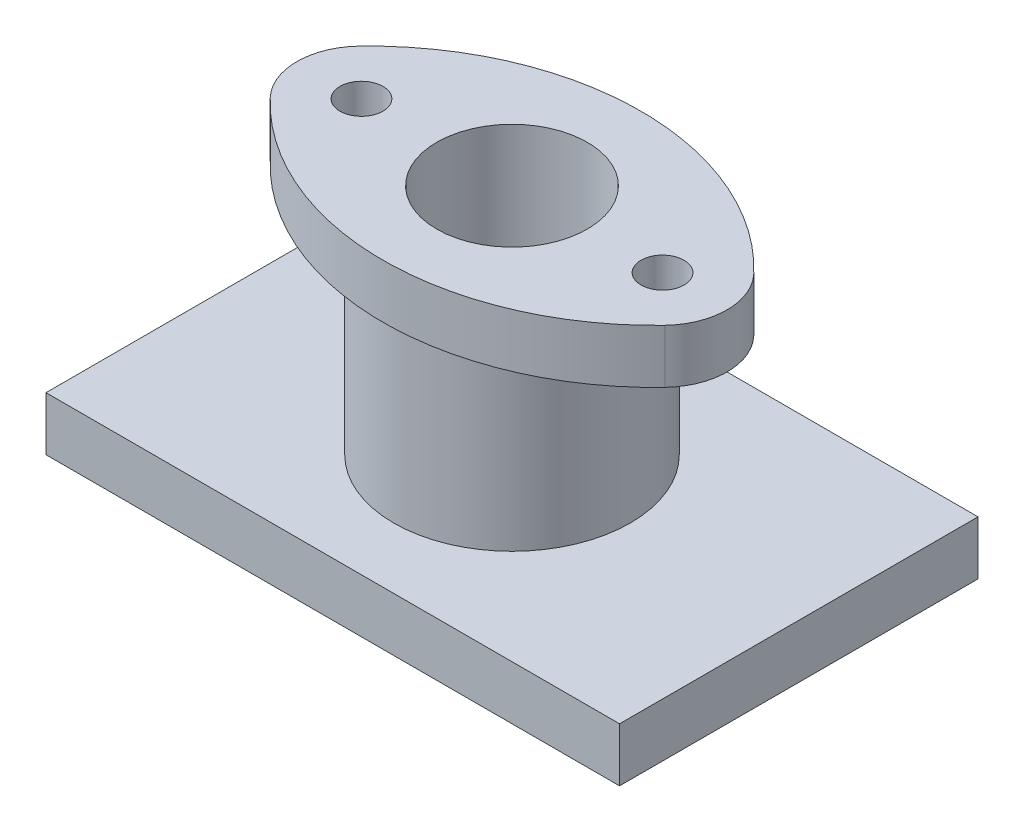
from build123d import *

# Parameters (mm, degrees)
SKETCH1_W           = 160
SKETCH1_H           = 100
BOSS_EXTRUDE1_DEPTH = 15
SKETCH3_R           = 16.5
CUT_EXTRUDE1_DEPTH  = 15
SKETCH2_R           = 33
BOSS_EXTRUDE2_DEPTH = 50
SKETCH6_R           = 6
BOSS_EXTRUDE4_DEPTH = 15
SKETCH7_R           = 21
CUT_EXTRUDE3_DEPTH  = 65


with BuildPart() as part:
    # Sketch1 → Boss-Extrude1 (new body)
    with BuildSketch(Plane(origin=(0, 0, 0), x_dir=(1, 0, 0), z_dir=(0, 1, 0))):
        Rectangle(SKETCH1_W, SKETCH1_H)
    extrude(amount=BOSS_EXTRUDE1_DEPTH)

    # Sketch3 → Cut-Extrude1 (cut)
    with BuildSketch(Plane.XZ):
        with Locations(Location((0, 0, 0), (0, 0, 270))):
            Circle(SKETCH3_R)
    extrude(amount=-CUT_EXTRUDE1_DEPTH, mode=Mode.SUBTRACT)

    # Sketch2 → Boss-Extrude2 (add)
    with BuildSketch(Plane(origin=(0, 15, 0), x_dir=(1, 0, 0), z_dir=(0, 1, 0))):
        with Locations(Location((0, 0, 0), (0, 0, 270))):
            Circle(SKETCH2_R)
    extrude(amount=BOSS_EXTRUDE2_DEPTH)

    # Sketch6 → Boss-Extrude4 (add)
    with BuildSketch(Plane(origin=(0, 65, 0), x_dir=(1, 0, 0), z_dir=(0, 1, 0))):
        with BuildLine():
            ThreePointArc((-55.034482759, 12.413793103), (-60, 0), (-55.034482759, -12.413793103))
            ThreePointArc((-55.034482759, -12.413793103), (0, -36), (55.034482759, -12.413793103))
            ThreePointArc((55.034482759, -12.413793103), (60, 0), (55.034482759, 12.413793103))
            ThreePointArc((55.034482759, 12.413793103), (0, 36), (-55.034482759, 12.413793103))
        make_face()
        with Locations(Location((-42, 0, 0), (0, 0, 270))):
            Circle(SKETCH6_R, mode=Mode.SUBTRACT)
        with Locations(Location((42, 0, 0), (0, 0, 270))):
            Circle(SKETCH6_R, mode=Mode.SUBTRACT)
    extrude(amount=BOSS_EXTRUDE4_DEPTH)

    # Sketch7 → Cut-Extrude3 (cut)
    with BuildSketch(Plane(origin=(0, 80, 0), x_dir=(1, 0, 0), z_dir=(0, 1, 0))):
        with Locations(Location((0, 0, 0), (0, 0, 270))):
            Circle(SKETCH7_R)
    extrude(amount=-CUT_EXTRUDE3_DEPTH, mode=Mode.SUBTRACT)


solid = part.part
